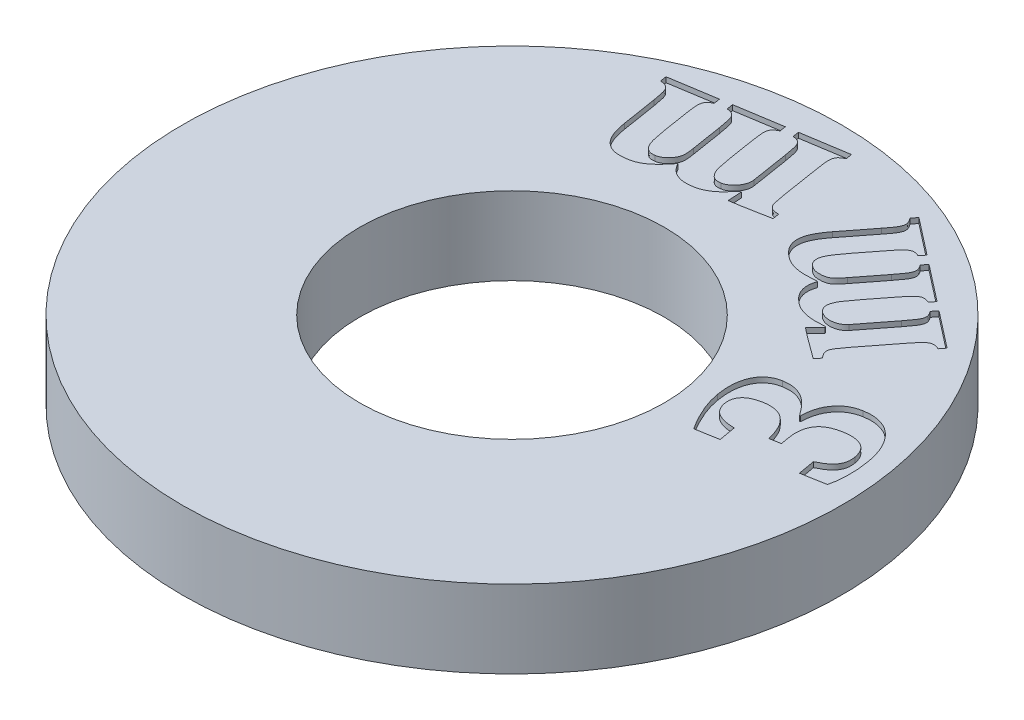
from build123d import *

# Parameters (mm, degrees)
SKETCH1_R           = 12.7
BOSS_EXTRUDE1_DEPTH = 3
SKETCH2_R           = 5.8674
CUT_EXTRUDE1_DEPTH  = 19.209338264
CUT_EXTRUDE2_DEPTH  = 0.2


with BuildPart() as part:
    # Sketch1 → Boss-Extrude1 (new body)
    with BuildSketch(Plane(origin=(0, 0, 0), x_dir=(1, 0, 0), z_dir=(0, 1, 0))):
        with Locations(Location((0, 0, 0), (0, 0, 270))):
            Circle(SKETCH1_R)
    extrude(amount=BOSS_EXTRUDE1_DEPTH)

    # Sketch2 → Cut-Extrude1 (cut, through all)
    with BuildSketch(Plane(origin=(0, 0, 0), x_dir=(-1, 0, 0), z_dir=(0, -1, 0))):
        with Locations(Location((0, 0, 0), (0, 0, 90))):
            Circle(SKETCH2_R)
    extrude(amount=-CUT_EXTRUDE1_DEPTH, mode=Mode.SUBTRACT)

    # Sketch4 → Cut-Extrude2 (cut)
    with BuildSketch(Plane(origin=(0, 3, 0), x_dir=(1, 0, 0), z_dir=(0, 1, 0))):
        with BuildLine():
            Line((8.164580493, -0.141111111), (7.299172507, -0.294348958))
            add(Edge.make_bspline(
                [(7.299172507, -0.294348958), (7.254126865, -0.224151115), (7.165775959, -0.086467583), (7.045489583, 0.122458288), (6.938429156, 0.327907963), (6.845588657, 0.530877084), (6.764550442, 0.729493953), (6.698650802, 0.925985441), (6.643082808, 1.118355277), (6.618049918, 1.247367299), (6.605743687, 1.310789931)],
                knots=[0, 0, 0, 0, 1.137107975, 2.23028277, 3.285789175, 4.29468346, 5.272556553, 6.20897527, 7.119527785, 8, 8, 8, 8], degree=3))
            add(Edge.make_bspline(
                [(6.605743687, 1.310789931), (6.594270562, 1.38377459), (6.571928431, 1.525900877), (6.558947636, 1.736162087), (6.562833216, 1.936093162), (6.58410888, 2.125025368), (6.624243067, 2.300223785), (6.682765182, 2.45978553), (6.758962892, 2.602442887), (6.853390282, 2.727545195), (6.965656947, 2.833485564), (7.09561771, 2.918642555), (7.242991414, 2.981053957), (7.348665157, 3.004327267), (7.402800979, 3.01625)],
                knots=[0, 0, 0, 0, 1.257534887, 2.448853862, 3.581761746, 4.659110775, 5.680658369, 6.634983106, 7.544925383, 8.424762642, 9.292432414, 10.160237565, 11.057504272, 12, 12, 12, 12], degree=3))
            add(Edge.make_bspline(
                [(7.402800979, 3.01625), (7.453401354, 3.02362584), (7.551680605, 3.037951664), (7.69794884, 3.040231883), (7.837573421, 3.024901552), (7.971110699, 2.992446158), (8.098362087, 2.944895478), (8.219666965, 2.882100332), (8.335895968, 2.805882639), (8.447266456, 2.713606621), (8.556444324, 2.606194026), (8.668901434, 2.484744861), (8.780212806, 2.344232093), (8.853239027, 2.243719149), (8.891082229, 2.191631944)],
                knots=[0, 0, 0, 0, 1.013739218, 1.968948484, 2.893245571, 3.793330219, 4.688470041, 5.581915844, 6.497952119, 7.440811012, 8.446231258, 9.53500789, 10.72260683, 12, 12, 12, 12], degree=3))
            Line((8.891082229, 2.191631944), (8.924155146, 2.198246528))
            add(Edge.make_bspline(
                [(8.924155146, 2.198246528), (8.924918634, 2.251967384), (8.926430196, 2.358324536), (8.947473771, 2.515402809), (8.979674955, 2.668205104), (9.028264793, 2.815080237), (9.091963081, 2.953896093), (9.170838403, 3.083595629), (9.266021551, 3.201490829), (9.375901049, 3.308259942), (9.500439904, 3.401525353), (9.641028101, 3.476619078), (9.795253083, 3.534806257), (9.904558779, 3.557876025), (9.960439868, 3.569670139)],
                knots=[0, 0, 0, 0, 1.026335185, 2.031949896, 3.024124183, 4.008331677, 4.982837344, 5.938341286, 6.902791705, 7.871633439, 8.860843291, 9.866752457, 10.909405448, 12, 12, 12, 12], degree=3))
            add(Edge.make_bspline(
                [(9.960439868, 3.569670139), (10.02973183, 3.579810447), (10.165317884, 3.59965235), (10.368599346, 3.594073048), (10.564481426, 3.562117282), (10.721811743, 3.512715037), (10.841751206, 3.458209336), (10.929302634, 3.411216165), (11.012460066, 3.355066353), (11.093066227, 3.292408771), (11.170330286, 3.221492934), (11.244348579, 3.142988141), (11.31460909, 3.056826737), (11.382174158, 2.963848054), (11.446012474, 2.864003809), (11.504277471, 2.757036048), (11.557126893, 2.64330511), (11.607411674, 2.523988889), (11.649279477, 2.396241197), (11.689640871, 2.263161114), (11.723823342, 2.122933348), (11.741692043, 2.026728187), (11.75078709, 1.977760417)],
                knots=[0, 0, 0, 0, 1.552055264, 3.036961932, 4.491926841, 5.946868886, 6.680668832, 7.414332759, 8.149582009, 8.905049753, 9.678705273, 10.474991778, 11.297986015, 12.144768462, 13.024991339, 13.926610153, 14.846130849, 15.808017766, 16.798530401, 17.828267102, 18.894602771, 20, 20, 20, 20], degree=3))
            add(Edge.make_bspline(
                [(11.75078709, 1.977760417), (11.762170129, 1.909141634), (11.784865898, 1.772327898), (11.805834162, 1.566157462), (11.820237717, 1.360255663), (11.821432039, 1.156401104), (11.815751139, 0.958057912), (11.799090489, 0.769266598), (11.773822813, 0.591512389), (11.74718336, 0.478296539), (11.734250632, 0.423333333)],
                knots=[0, 0, 0, 0, 1.066248548, 2.125911334, 3.176109364, 4.22982333, 5.250230149, 6.217431478, 7.134611624, 8, 8, 8, 8], degree=3))
            Line((11.734250632, 0.423333333), (10.81702841, 0.260173611))
            Line((10.81702841, 0.260173611), (10.700170771, 0.917222222))
            add(Edge.make_bspline(
                [(10.700170771, 0.917222222), (10.762179027, 0.947249342), (10.87880441, 1.003724473), (11.034174858, 1.101751404), (11.158720401, 1.206462209), (11.253775922, 1.319041601), (11.319999677, 1.441297519), (11.357555629, 1.573998106), (11.369098331, 1.717631478), (11.355492256, 1.8147095), (11.348399937, 1.8653125)],
                knots=[0, 0, 0, 0, 1.315010116, 2.473276457, 3.498567572, 4.410559322, 5.270838744, 6.132605253, 7.026599701, 8, 8, 8, 8], degree=3))
            add(Edge.make_bspline(
                [(11.348399937, 1.8653125), (11.341875398, 1.896288119), (11.329168234, 1.956616093), (11.303022935, 2.042880304), (11.269570612, 2.121812102), (11.230594454, 2.193837832), (11.183135666, 2.256957094), (11.131530054, 2.314555266), (11.071096113, 2.362472217), (11.00586727, 2.405220266), (10.933755742, 2.439162109), (10.855303799, 2.465778349), (10.770761853, 2.485449867), (10.67922078, 2.497494268), (10.581482565, 2.501671969), (10.477666576, 2.497756593), (10.36751511, 2.48816074), (10.292571495, 2.47583813), (10.253686396, 2.469444444)],
                knots=[0, 0, 0, 0, 1.062681572, 2.069673814, 3.020757619, 3.937606762, 4.811257529, 5.667036378, 6.526543355, 7.392491981, 8.281089848, 9.194194867, 10.169932879, 11.190815326, 12.290117787, 13.450598505, 14.67722244, 16, 16, 16, 16], degree=3))
            add(Edge.make_bspline(
                [(10.253686396, 2.469444444), (10.21236047, 2.46132416), (10.131880827, 2.445510415), (10.017411818, 2.410878653), (9.912269196, 2.370828699), (9.817507825, 2.322327855), (9.730958567, 2.269412482), (9.655575618, 2.206825721), (9.589554436, 2.137741036), (9.533205575, 2.061467789), (9.486328214, 1.977858623), (9.449830602, 1.88666702), (9.423879767, 1.788072069), (9.406187836, 1.682170703), (9.397512474, 1.568922063), (9.398928891, 1.448354811), (9.410343924, 1.320580603), (9.424126681, 1.23354771), (9.431273201, 1.188420139)],
                knots=[0, 0, 0, 0, 1.154959404, 2.249210876, 3.277206245, 4.237710271, 5.166517796, 6.054758483, 6.917744217, 7.78290676, 8.649654335, 9.540923156, 10.470387237, 11.441785199, 12.483486141, 13.582604788, 14.746552339, 16, 16, 16, 16], degree=3))
            Line((9.431273201, 1.188420139), (9.481985007, 0.900685764))
            Line((9.481985007, 0.900685764), (9.065266257, 0.826822917))
            add(Edge.make_bspline(
                [(9.065266257, 0.826822917), (9.053323817, 0.877676496), (9.030137799, 0.976407744), (8.987244973, 1.117988979), (8.937533381, 1.248770458), (8.881792532, 1.368690848), (8.819830871, 1.477481839), (8.752229286, 1.575466019), (8.678817317, 1.662719018), (8.598729466, 1.738292833), (8.513214815, 1.803047835), (8.421509279, 1.856340144), (8.323475539, 1.896941453), (8.220208249, 1.927841187), (8.110287748, 1.942901187), (7.995250364, 1.950152445), (7.874369093, 1.944561747), (7.792962145, 1.931532679), (7.751169035, 1.92484375)],
                knots=[0, 0, 0, 0, 1.29334587, 2.511006204, 3.66023295, 4.755331661, 5.78245763, 6.75683239, 7.69945718, 8.600673867, 9.477910914, 10.350415315, 11.219115034, 12.100354848, 13.011532052, 13.959500513, 14.952438064, 16, 16, 16, 16], degree=3))
            add(Edge.make_bspline(
                [(7.751169035, 1.92484375), (7.718361479, 1.918684397), (7.654878827, 1.906766043), (7.56449535, 1.882070779), (7.481027571, 1.854805546), (7.404677013, 1.822802045), (7.334829516, 1.786487271), (7.272164335, 1.74578084), (7.216101005, 1.701748524), (7.168731337, 1.652587746), (7.127375298, 1.600945568), (7.093993557, 1.544819854), (7.06728175, 1.485362703), (7.048847784, 1.421835625), (7.036374118, 1.355396311), (7.032194914, 1.285454635), (7.035753428, 1.211992754), (7.042982253, 1.16228153), (7.04671591, 1.136605903)],
                knots=[0, 0, 0, 0, 1.330790509, 2.575080919, 3.733736543, 4.830684231, 5.873010726, 6.868969425, 7.807408956, 8.709078305, 9.585745051, 10.440327213, 11.306394197, 12.178146853, 13.072160606, 13.997345489, 14.965637813, 16, 16, 16, 16], degree=3))
            add(Edge.make_bspline(
                [(7.04671591, 1.136605903), (7.053004764, 1.107385859), (7.065390456, 1.04983794), (7.095730836, 0.96773557), (7.134678797, 0.890623747), (7.18316375, 0.818478839), (7.243733132, 0.751860879), (7.318753902, 0.693659581), (7.406941065, 0.641629631), (7.508842162, 0.596349572), (7.624681245, 0.560613729), (7.753820566, 0.534008848), (7.896341682, 0.519118617), (7.995874441, 0.51702704), (8.047722854, 0.5159375)],
                knots=[0, 0, 0, 0, 0.831011314, 1.636649549, 2.42794293, 3.230719671, 4.048727296, 4.922444941, 5.862595765, 6.892733277, 8.018408123, 9.229923594, 10.557017127, 12, 12, 12, 12], degree=3))
            Line((8.047722854, 0.5159375), (8.164580493, -0.141111111))
        make_face()
        with BuildLine():
            Line((6.446112276, 5.621046804), (6.418551512, 5.656324582))
            add(Edge.make_bspline(
                [(6.418551512, 5.656324582), (6.345103003, 5.650481726), (6.205690041, 5.639391375), (6.006049673, 5.640001619), (5.827169527, 5.650699674), (5.666856777, 5.67597167), (5.521469939, 5.714933464), (5.387561193, 5.768451828), (5.261579098, 5.83414063), (5.185430088, 5.889090651), (5.147449081, 5.916498193)],
                knots=[0, 0, 0, 0, 1.328700104, 2.522011983, 3.598465663, 4.558669638, 5.444794913, 6.307777922, 7.155966722, 8, 8, 8, 8], degree=3))
            add(Edge.make_bspline(
                [(5.147449081, 5.916498193), (5.113549109, 5.943897718), (5.048106477, 5.996791479), (4.961452983, 6.081290035), (4.888569595, 6.165417061), (4.830459206, 6.250285271), (4.784446219, 6.336029232), (4.750511209, 6.423590405), (4.725338541, 6.51279674), (4.712276312, 6.605066622), (4.710185373, 6.700889708), (4.719470407, 6.800614492), (4.739279008, 6.904788894), (4.760550248, 6.974274273), (4.771520262, 7.010109304)],
                knots=[0, 0, 0, 0, 1.254723853, 2.422197594, 3.480533536, 4.455073735, 5.378270259, 6.276377898, 7.154433995, 8.041941717, 8.952311201, 9.908521309, 10.921381655, 12, 12, 12, 12], degree=3))
            add(Edge.make_bspline(
                [(4.771520262, 7.010109304), (4.691090698, 7.003656459), (4.538471998, 6.991411896), (4.321666343, 6.98846259), (4.129911724, 6.995416816), (3.960718577, 7.018564153), (3.808601542, 7.056299759), (3.667745769, 7.110172456), (3.535147857, 7.17881181), (3.454567942, 7.236924978), (3.414428248, 7.265873193)],
                knots=[0, 0, 0, 0, 1.366310217, 2.59263486, 3.670585393, 4.613332156, 5.479848919, 6.319088227, 7.162678639, 8, 8, 8, 8], degree=3))
            add(Edge.make_bspline(
                [(3.414428248, 7.265873193), (3.3775521, 7.295803428), (3.306764809, 7.353257376), (3.21306857, 7.444735382), (3.134735925, 7.535260481), (3.072420666, 7.626680072), (3.027114725, 7.721083516), (2.993029681, 7.816985205), (2.9748084, 7.916670154), (2.967827049, 8.01881721), (2.974809687, 8.124007378), (2.995095498, 8.231959079), (3.028806982, 8.342103336), (3.074329878, 8.45600405), (3.135236882, 8.572567121), (3.206795227, 8.695687314), (3.293019282, 8.822881794), (3.357079528, 8.907680315), (3.390174776, 8.951489512)],
                knots=[0, 0, 0, 0, 1.169264857, 2.244515684, 3.220319539, 4.113963992, 4.959955291, 5.792870505, 6.612950669, 7.447388896, 8.308923635, 9.201834464, 10.146760853, 11.141726431, 12.218423767, 13.382633535, 14.647798067, 16, 16, 16, 16], degree=3))
            Line((3.390174776, 8.951489512), (4.221407414, 10.019744721))
            add(Edge.make_bspline(
                [(4.221407414, 10.019744721), (4.253451667, 10.061583607), (4.315528507, 10.14263483), (4.402700621, 10.258852189), (4.474099835, 10.363054012), (4.52285553, 10.455601314), (4.552580969, 10.535251364), (4.563466398, 10.608503251), (4.558254548, 10.679867299), (4.53147758, 10.75154504), (4.489681708, 10.826689156), (4.454202161, 10.876320457), (4.435278942, 10.902791596)],
                knots=[0, 0, 0, 0, 1.558183804, 3.018548385, 4.296309646, 5.28770402, 6.105589718, 6.797073249, 7.462098622, 8.197436721, 9.038592567, 10, 10, 10, 10], degree=3))
            Line((4.435278942, 10.902791596), (4.585209498, 11.095716943))
            Line((4.585209498, 11.095716943), (5.996320609, 9.99769611))
            Line((5.996320609, 9.99769611), (5.846390053, 9.804770762))
            add(Edge.make_bspline(
                [(5.846390053, 9.804770762), (5.821598554, 9.814853431), (5.775331585, 9.833670142), (5.707363836, 9.85237221), (5.646143658, 9.858436215), (5.590929353, 9.853196728), (5.540343575, 9.836119226), (5.490007513, 9.81172786), (5.439948532, 9.776609976), (5.384915117, 9.732987716), (5.324969903, 9.670799848), (5.252764521, 9.589061458), (5.16514284, 9.485038198), (5.10380747, 9.40664927), (5.070278942, 9.36379854)],
                knots=[0, 0, 0, 0, 0.974495288, 1.818645247, 2.55789592, 3.203887047, 3.821953837, 4.492443581, 5.234959137, 6.043992897, 7.047297203, 8.374577793, 10.01818969, 12, 12, 12, 12], degree=3))
            Line((5.070278942, 9.36379854), (4.459532414, 8.578867985))
            add(Edge.make_bspline(
                [(4.459532414, 8.578867985), (4.427040039, 8.536727017), (4.36533113, 8.456693682), (4.279860313, 8.340926267), (4.207480509, 8.23488918), (4.144743666, 8.140152652), (4.093939387, 8.053261371), (4.055224804, 7.972382939), (4.025674683, 7.897486598), (4.007618905, 7.827463577), (3.999758774, 7.762907557), (3.999966382, 7.703395202), (4.005428339, 7.648104338), (4.021722039, 7.597238119), (4.045740851, 7.549179791), (4.078974228, 7.503189368), (4.121883321, 7.458704343), (4.154616135, 7.431294161), (4.171798039, 7.416906179)],
                knots=[0, 0, 0, 0, 1.888953508, 3.587465034, 5.107152686, 6.445866775, 7.620537267, 8.676590056, 9.626254862, 10.474157069, 11.23623705, 11.927603465, 12.58451522, 13.199276758, 13.811819934, 14.485105834, 15.204811187, 16, 16, 16, 16], degree=3))
            add(Edge.make_bspline(
                [(4.171798039, 7.416906179), (4.196907921, 7.398623115), (4.24575502, 7.363056452), (4.329546375, 7.32690278), (4.419900083, 7.306286873), (4.515987475, 7.298075567), (4.611843152, 7.301326536), (4.703352488, 7.308761322), (4.788476175, 7.328417137), (4.868537558, 7.362467429), (4.944132959, 7.410449543), (5.003782637, 7.463505766), (5.054181963, 7.517595359), (5.101176163, 7.571027473), (5.155289779, 7.638105142), (5.193805445, 7.686959904), (5.214697345, 7.713459999)],
                knots=[0, 0, 0, 0, 1.060451807, 2.062932707, 3.097103212, 4.220994073, 5.353228603, 6.376944908, 7.359261765, 8.328691766, 9.340596163, 10.410182602, 11.05076008, 11.870698325, 12.845011315, 14, 14, 14, 14], degree=3))
            Line((5.214697345, 7.713459999), (5.957735539, 8.66816486))
            add(Edge.make_bspline(
                [(5.957735539, 8.66816486), (5.982092993, 8.699319813), (6.027952625, 8.757977615), (6.090423825, 8.841053313), (6.142342187, 8.913544593), (6.197870379, 8.990195), (6.249297759, 9.073408186), (6.29114706, 9.165636672), (6.310604917, 9.252795431), (6.30324831, 9.324426645), (6.285186466, 9.381667531), (6.264023921, 9.429739499), (6.232698883, 9.48084353), (6.207857504, 9.515367573), (6.194758109, 9.533572846)],
                knots=[0, 0, 0, 0, 1.428852229, 2.69020885, 3.755221618, 4.650440021, 6.110052653, 7.281631402, 8.297160143, 9.297295893, 9.839073942, 10.463254767, 11.189641066, 12, 12, 12, 12], degree=3))
            Line((6.194758109, 9.533572846), (6.344688664, 9.726498193))
            Line((6.344688664, 9.726498193), (7.739263317, 8.640604096))
            Line((7.739263317, 8.640604096), (7.589332762, 8.447678749))
            add(Edge.make_bspline(
                [(7.589332762, 8.447678749), (7.564184317, 8.458169169), (7.516888214, 8.477898261), (7.447738497, 8.497032573), (7.385486432, 8.504959726), (7.329450384, 8.499379022), (7.278376194, 8.482329334), (7.227319552, 8.459564119), (7.178554253, 8.423744301), (7.124521011, 8.380289164), (7.065790511, 8.31767881), (6.99307334, 8.236382683), (6.90602346, 8.130825514), (6.84391499, 8.052041093), (6.809914359, 8.008911387)],
                knots=[0, 0, 0, 0, 0.986342731, 1.854992093, 2.591493093, 3.247165752, 3.874524497, 4.535580437, 5.263002682, 6.057269968, 7.045676649, 8.365642244, 10.010408946, 12, 12, 12, 12], degree=3))
            Line((6.809914359, 8.008911387), (6.199167831, 7.223980832))
            add(Edge.make_bspline(
                [(6.199167831, 7.223980832), (6.1751448, 7.193217202), (6.128820384, 7.133894666), (6.064470667, 7.047003547), (6.005667413, 6.967536238), (5.953399564, 6.894695326), (5.908577343, 6.827540339), (5.869029665, 6.766708727), (5.837481339, 6.710333021), (5.802625077, 6.644943933), (5.770963015, 6.567952334), (5.744339164, 6.480543218), (5.734321689, 6.398573054), (5.736407268, 6.323235217), (5.755317287, 6.253747629), (5.786992728, 6.186877603), (5.838949571, 6.122592111), (5.883831274, 6.085438123), (5.908126164, 6.065326318)],
                knots=[0, 0, 0, 0, 1.387103131, 2.674797394, 3.842386028, 4.900548409, 5.86041802, 6.711809731, 7.478006622, 8.155605191, 9.344042684, 10.43114453, 11.391724629, 12.267604767, 13.091197959, 13.932310922, 14.880740337, 16, 16, 16, 16], degree=3))
            add(Edge.make_bspline(
                [(5.908126164, 6.065326318), (5.92724958, 6.05188526), (5.966036324, 6.024623661), (6.032692056, 5.993550347), (6.107049239, 5.971043667), (6.187819264, 5.954527731), (6.272883487, 5.946510823), (6.359519721, 5.950174322), (6.446294721, 5.963823989), (6.53258789, 5.986026651), (6.614596751, 6.020389001), (6.690833791, 6.063035119), (6.757619821, 6.117520035), (6.794712531, 6.160658186), (6.813221651, 6.182183957)],
                knots=[0, 0, 0, 0, 0.841485411, 1.706728545, 2.636983739, 3.637338779, 4.674903333, 5.709078804, 6.7546484, 7.837656936, 8.912857559, 9.95143668, 10.977774795, 12, 12, 12, 12], degree=3))
            Line((6.813221651, 6.182183957), (7.695166095, 7.315482568))
            add(Edge.make_bspline(
                [(7.695166095, 7.315482568), (7.728014018, 7.358000395), (7.788496594, 7.436288075), (7.869304066, 7.544976045), (7.931241751, 7.634991871), (7.976730187, 7.708273557), (8.008966806, 7.771056115), (8.029709996, 7.829288183), (8.042924298, 7.885143031), (8.045069208, 7.940051692), (8.037490603, 7.996136863), (8.014924563, 8.054405487), (7.980117392, 8.116225886), (7.950303267, 8.156952636), (7.934393526, 8.178685693)],
                knots=[0, 0, 0, 0, 1.946253878, 3.583619155, 4.90541557, 5.903065839, 6.706730513, 7.456203084, 8.137693296, 8.777198399, 9.436082692, 10.17303834, 11.025076595, 12, 12, 12, 12], degree=3))
            Line((7.934393526, 8.178685693), (8.084324081, 8.37161104))
            Line((8.084324081, 8.37161104), (9.487718178, 7.27910236))
            Line((9.487718178, 7.27910236), (9.337787623, 7.086177012))
            add(Edge.make_bspline(
                [(9.337787623, 7.086177012), (9.310775429, 7.0966318), (9.260723911, 7.116003717), (9.187673864, 7.135537847), (9.123019149, 7.144452452), (9.064830325, 7.140087962), (9.012522306, 7.124265196), (8.960801373, 7.102391813), (8.910212078, 7.069482703), (8.856472687, 7.026121446), (8.796761068, 6.965984534), (8.724427609, 6.885322286), (8.638553239, 6.78089514), (8.576615815, 6.702998059), (8.542935192, 6.660638818)],
                knots=[0, 0, 0, 0, 1.0399122, 1.926877353, 2.71123319, 3.373420874, 4.004478301, 4.666665984, 5.384545304, 6.163885671, 7.144097132, 8.424650005, 10.055779381, 12, 12, 12, 12], degree=3))
            Line((8.542935192, 6.660638818), (7.60586922, 5.456784651))
            add(Edge.make_bspline(
                [(7.60586922, 5.456784651), (7.579695927, 5.423041412), (7.531000421, 5.360261992), (7.464615767, 5.272214489), (7.410772827, 5.196862452), (7.35505243, 5.118965683), (7.3062141, 5.034369264), (7.266301268, 4.941020505), (7.257033, 4.850826575), (7.268994039, 4.777697278), (7.294307526, 4.717385158), (7.326608903, 4.665864149), (7.367927347, 4.606464412), (7.401556879, 4.566478611), (7.419558456, 4.545074582)],
                knots=[0, 0, 0, 0, 1.450639645, 2.698920323, 3.745170182, 4.597024574, 5.950243738, 7.060652374, 8.014587129, 8.989365666, 9.543411076, 10.226324432, 11.050567859, 12, 12, 12, 12], degree=3))
            Line((7.419558456, 4.545074582), (7.264115748, 4.345534651))
            Line((7.264115748, 4.345534651), (6.442804984, 4.947461735))
            Line((6.442804984, 4.947461735), (6.074593178, 5.234093679))
            Line((6.074593178, 5.234093679), (6.446112276, 5.621046804))
        make_face()
        with BuildLine():
            Line((0.313853362, 8.525956305), (0.266448848, 8.530366027))
            add(Edge.make_bspline(
                [(0.266448848, 8.530366027), (0.220587801, 8.472712263), (0.133110419, 8.362740934), (-0.004365315, 8.216579062), (-0.134419634, 8.091399905), (-0.26345541, 7.991600635), (-0.391287899, 7.911021784), (-0.522521219, 7.849326117), (-0.657183893, 7.801559088), (-0.750062007, 7.783960964), (-0.796294208, 7.775201097)],
                knots=[0, 0, 0, 0, 1.321709555, 2.521087024, 3.598960819, 4.558109064, 5.44394598, 6.305457593, 7.156502851, 8, 8, 8, 8], degree=3))
            add(Edge.make_bspline(
                [(-0.796294208, 7.775201097), (-0.839944877, 7.768960851), (-0.923669459, 7.756991687), (-1.045452622, 7.751329453), (-1.157309896, 7.756606178), (-1.259753383, 7.771731323), (-1.354164127, 7.797300062), (-1.441453203, 7.833576517), (-1.52489044, 7.87569231), (-1.601582422, 7.92961482), (-1.673310621, 7.993632909), (-1.739982334, 8.068486542), (-1.802626549, 8.154631273), (-1.839037783, 8.217645133), (-1.857934833, 8.250348666)],
                knots=[0, 0, 0, 0, 1.262383675, 2.421327046, 3.485651979, 4.465097507, 5.381738202, 6.278834679, 7.168553644, 8.05321575, 8.955237983, 9.91670527, 10.918791849, 12, 12, 12, 12], degree=3))
            add(Edge.make_bspline(
                [(-1.857934833, 8.250348666), (-1.90877596, 8.187008607), (-2.00522163, 8.066852448), (-2.151117808, 7.90429903), (-2.290041501, 7.770169918), (-2.42237, 7.660920578), (-2.554191293, 7.574649228), (-2.690177048, 7.508178238), (-2.831656224, 7.457141582), (-2.929902909, 7.438416019), (-2.979106708, 7.429037902)],
                knots=[0, 0, 0, 0, 1.367019779, 2.593237953, 3.673809289, 4.614754209, 5.477752088, 6.31872209, 7.157984213, 8, 8, 8, 8], degree=3))
            add(Edge.make_bspline(
                [(-2.979106708, 7.429037902), (-3.026059084, 7.422313077), (-3.116363637, 7.40937907), (-3.247369376, 7.404275703), (-3.367795645, 7.408861262), (-3.477868354, 7.42618411), (-3.579049507, 7.456379764), (-3.672210418, 7.498761458), (-3.759200344, 7.552032666), (-3.839177412, 7.617470965), (-3.910830954, 7.695734725), (-3.976479508, 7.784665243), (-4.034537182, 7.885532337), (-4.086457137, 7.997681719), (-4.132118696, 8.122243067), (-4.168735586, 8.260041405), (-4.205840999, 8.409494464), (-4.222701413, 8.514404278), (-4.231467819, 8.568951097)],
                knots=[0, 0, 0, 0, 1.161439086, 2.233821674, 3.207260032, 4.110189863, 4.956199937, 5.786297692, 6.610908432, 7.449024294, 8.309099073, 9.204093284, 10.152261841, 11.155272774, 12.229128442, 13.397873342, 14.647050006, 16, 16, 16, 16], degree=3))
            Line((-4.231467819, 8.568951097), (-4.445339347, 9.915018805))
            add(Edge.make_bspline(
                [(-4.445339347, 9.915018805), (-4.453968854, 9.967233872), (-4.470648589, 10.068158929), (-4.49743887, 10.211380795), (-4.524685526, 10.335077023), (-4.557401262, 10.434852747), (-4.596893377, 10.510944501), (-4.643015377, 10.569856606), (-4.700587884, 10.614839055), (-4.771670566, 10.64401948), (-4.854978101, 10.666808477), (-4.91554102, 10.67330914), (-4.94804768, 10.676798319)],
                knots=[0, 0, 0, 0, 1.556776784, 3.009050718, 4.285993182, 5.280798359, 6.088364277, 6.795732101, 7.466033526, 8.211290206, 9.039924425, 10, 10, 10, 10], degree=3))
            Line((-4.94804768, 10.676798319), (-4.986632749, 10.920435472))
            Line((-4.986632749, 10.920435472), (-3.209514694, 11.202657694))
            Line((-3.209514694, 11.202657694), (-3.170929624, 10.959020541))
            add(Edge.make_bspline(
                [(-3.170929624, 10.959020541), (-3.1955222, 10.948274173), (-3.241636376, 10.928123379), (-3.301383001, 10.890257762), (-3.349616556, 10.851198802), (-3.382533123, 10.806155645), (-3.405703355, 10.757404121), (-3.419878086, 10.703054317), (-3.431779295, 10.642767853), (-3.435574724, 10.57245081), (-3.432618312, 10.485524547), (-3.422064489, 10.375927445), (-3.403820359, 10.240039117), (-3.388657088, 10.140990442), (-3.38039143, 10.086997972)],
                knots=[0, 0, 0, 0, 0.969779354, 1.818458417, 2.554157673, 3.20052523, 3.8192083, 4.496967745, 5.227358508, 6.040378365, 7.038205311, 8.373543936, 10.023180803, 12, 12, 12, 12], degree=3))
            Line((-3.38039143, 10.086997972), (-3.223846291, 9.099220194))
            add(Edge.make_bspline(
                [(-3.223846291, 9.099220194), (-3.215227763, 9.046636467), (-3.198810146, 8.946468614), (-3.172292417, 8.804233798), (-3.146374998, 8.677591368), (-3.119216219, 8.56625168), (-3.088752441, 8.469337514), (-3.058340166, 8.383915324), (-3.020988556, 8.311907887), (-2.983052645, 8.250047646), (-2.9403307, 8.200299225), (-2.896928005, 8.158691062), (-2.852193168, 8.125100637), (-2.803967184, 8.101198407), (-2.752634363, 8.085140565), (-2.695940612, 8.079901249), (-2.634163691, 8.077597969), (-2.591377829, 8.083895558), (-2.569002541, 8.087188944)],
                knots=[0, 0, 0, 0, 1.879302477, 3.579923031, 5.102516498, 6.43847557, 7.619109878, 8.685516954, 9.630316028, 10.475250734, 11.238613256, 11.935364263, 12.593814088, 13.202415535, 13.825608582, 14.478293096, 15.204208384, 16, 16, 16, 16], degree=3))
            add(Edge.make_bspline(
                [(-2.569002541, 8.087188944), (-2.538163079, 8.093382104), (-2.478532253, 8.105357128), (-2.394656651, 8.14283353), (-2.317494931, 8.195021488), (-2.24573651, 8.260419012), (-2.181107746, 8.332153066), (-2.123831091, 8.404596344), (-2.079289987, 8.480367808), (-2.050670586, 8.56285552), (-2.034279614, 8.650879435), (-2.03038681, 8.730698931), (-2.035644191, 8.804578121), (-2.042089163, 8.876314479), (-2.053342192, 8.963059354), (-2.063191476, 9.025749928), (-2.068499069, 9.059532694)],
                knots=[0, 0, 0, 0, 1.066239177, 2.061667717, 3.097334799, 4.220563205, 5.352161382, 6.376319012, 7.355316561, 8.323097728, 9.327340028, 10.390062672, 11.0280924, 11.843315407, 12.837803384, 14, 14, 14, 14], degree=3))
            Line((-2.068499069, 9.059532694), (-2.259219555, 10.261182))
            add(Edge.make_bspline(
                [(-2.259219555, 10.261182), (-2.265189068, 10.300550507), (-2.276367674, 10.374272601), (-2.296122881, 10.476856372), (-2.311449485, 10.565092055), (-2.333244723, 10.658190139), (-2.357413956, 10.753633086), (-2.397599585, 10.847457095), (-2.4488931, 10.920993429), (-2.506101212, 10.965507213), (-2.560536594, 10.991486992), (-2.609969791, 11.008449388), (-2.668336298, 11.019413766), (-2.710093776, 11.025341112), (-2.732162263, 11.028473666)],
                knots=[0, 0, 0, 0, 1.433434736, 2.68427268, 3.761168802, 4.656659373, 6.126928261, 7.29968854, 8.313279962, 9.321676997, 9.866066009, 10.48111294, 11.19728056, 12, 12, 12, 12], degree=3))
            Line((-2.732162263, 11.028473666), (-2.770747333, 11.272110819))
            Line((-2.770747333, 11.272110819), (-1.016780319, 11.549923319))
            Line((-1.016780319, 11.549923319), (-0.978195249, 11.306286166))
            add(Edge.make_bspline(
                [(-0.978195249, 11.306286166), (-1.003539507, 11.295588296), (-1.05081222, 11.275634372), (-1.111895494, 11.237496403), (-1.161160656, 11.198478729), (-1.195529293, 11.153275612), (-1.219332957, 11.104376677), (-1.233858811, 11.049994325), (-1.245845766, 10.990428501), (-1.248131032, 10.920389717), (-1.244252884, 10.834232839), (-1.232099021, 10.724754883), (-1.214563153, 10.58839066), (-1.199286672, 10.488617856), (-1.190964347, 10.434263597)],
                knots=[0, 0, 0, 0, 0.989028705, 1.844759954, 2.586937196, 3.238107674, 3.871415783, 4.533125195, 5.259921945, 6.054965184, 7.048323037, 8.365174644, 10.01981869, 12, 12, 12, 12], degree=3))
            Line((-1.190964347, 10.434263597), (-1.034419208, 9.446485819))
            add(Edge.make_bspline(
                [(-1.034419208, 9.446485819), (-1.028284705, 9.407515179), (-1.016522902, 9.332796012), (-0.997794986, 9.225472348), (-0.978788568, 9.127843148), (-0.957118142, 9.015092544), (-0.92713746, 8.896731465), (-0.890202667, 8.776099361), (-0.846829242, 8.680304169), (-0.799827341, 8.60076994), (-0.746857119, 8.537114013), (-0.691097612, 8.485253813), (-0.626591832, 8.452528987), (-0.556339665, 8.428456815), (-0.472992748, 8.422934964), (-0.414757912, 8.430379669), (-0.382882749, 8.434454569)],
                knots=[0, 0, 0, 0, 1.217997893, 2.335291105, 3.363301837, 4.288921831, 5.879406356, 7.131588601, 8.17759787, 9.119347984, 9.973511448, 10.729163452, 11.449941662, 12.189059626, 13.008771681, 14, 14, 14, 14], degree=3))
            add(Edge.make_bspline(
                [(-0.382882749, 8.434454569), (-0.359875434, 8.438812656), (-0.312670065, 8.447754381), (-0.244525142, 8.476737934), (-0.176304789, 8.514964956), (-0.108641116, 8.562544432), (-0.045650694, 8.620933806), (0.012522922, 8.686043096), (0.061956884, 8.7593599), (0.103685428, 8.838283335), (0.136408142, 8.921606199), (0.154309625, 9.007588437), (0.162701488, 9.094558661), (0.155463208, 9.151799875), (0.15179607, 9.180800055)],
                knots=[0, 0, 0, 0, 0.835871289, 1.715002913, 2.633388593, 3.633187471, 4.666417129, 5.700650574, 6.751143417, 7.821774814, 8.891517419, 9.941351542, 10.95702464, 12, 12, 12, 12], degree=3))
            Line((0.15179607, 9.180800055), (-0.074202194, 10.607345194))
            add(Edge.make_bspline(
                [(-0.074202194, 10.607345194), (-0.0827033, 10.660686047), (-0.098328527, 10.758727753), (-0.124174258, 10.892356055), (-0.146107794, 11.000081328), (-0.168777011, 11.084461368), (-0.192328462, 11.151581226), (-0.219827574, 11.207320309), (-0.252192214, 11.254760428), (-0.290360467, 11.294727515), (-0.337845169, 11.326906546), (-0.395953257, 11.350746254), (-0.4656423, 11.366694908), (-0.515833552, 11.372583246), (-0.54273518, 11.375739291)],
                knots=[0, 0, 0, 0, 1.944391131, 3.573835333, 4.89976862, 5.901119108, 6.717182758, 7.456739864, 8.131968056, 8.777512876, 9.434346179, 10.181320822, 11.025219969, 12, 12, 12, 12], degree=3))
            Line((-0.54273518, 11.375739291), (-0.581320249, 11.619376444))
            Line((-0.581320249, 11.619376444), (1.18367107, 11.898291375))
            Line((1.18367107, 11.898291375), (1.22225614, 11.654654222))
            add(Edge.make_bspline(
                [(1.22225614, 11.654654222), (1.19625358, 11.642320887), (1.14785195, 11.619363395), (1.083956718, 11.579411666), (1.033199809, 11.537997656), (0.996115313, 11.492400193), (0.971907979, 11.442441633), (0.952327319, 11.389471255), (0.942318303, 11.329790665), (0.936003298, 11.261211079), (0.939860158, 11.175976409), (0.950170447, 11.067904886), (0.968541079, 10.933108835), (0.983606087, 10.834419647), (0.991848153, 10.780426791)],
                knots=[0, 0, 0, 0, 1.029437697, 1.916213766, 2.690941621, 3.364738409, 4.000075764, 4.6698806, 5.379325844, 6.158174325, 7.131901521, 8.426385959, 10.044875728, 12, 12, 12, 12], degree=3))
            Line((0.991848153, 10.780426791), (1.231075584, 9.265687208))
            add(Edge.make_bspline(
                [(1.231075584, 9.265687208), (1.237812541, 9.223017488), (1.250316557, 9.14382107), (1.271234809, 9.034259492), (1.286790608, 8.942078167), (1.306037446, 8.847585285), (1.33297969, 8.753531648), (1.375000791, 8.660340036), (1.434691793, 8.591618497), (1.496545931, 8.549250257), (1.558872086, 8.528494985), (1.618128233, 8.514144363), (1.690939166, 8.504851265), (1.743684451, 8.501383727), (1.772368987, 8.499497972)],
                knots=[0, 0, 0, 0, 1.45510247, 2.700718576, 3.757006257, 4.604314627, 5.947710583, 7.049444465, 8.014850273, 8.979620945, 9.531703584, 10.219269411, 11.031582988, 12, 12, 12, 12], degree=3))
            Line((1.772368987, 8.499497972), (1.812056487, 8.249246236))
            Line((1.812056487, 8.249246236), (0.80663982, 8.05962818))
            Line((0.80663982, 8.05962818), (0.341414126, 7.985765333))
            Line((0.341414126, 7.985765333), (0.313853362, 8.525956305))
        make_face()
    extrude(amount=-CUT_EXTRUDE2_DEPTH, mode=Mode.SUBTRACT)


solid = part.part
